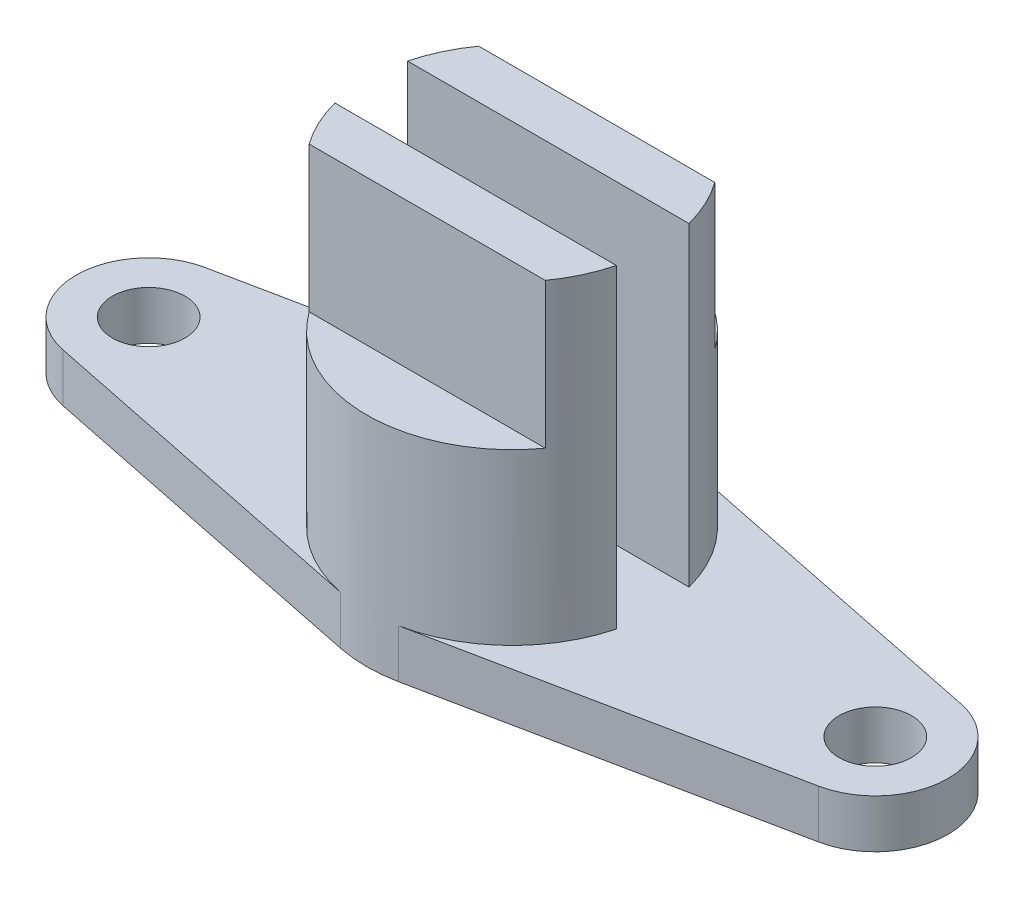
from build123d import *

# Parameters (mm, degrees)
SKETCH1_R               = 7.5
BOSS_EXTRUDE1_DEPTH     = 10
SKETCH2_R               = 30
BOSS_EXTRUDE2_DEPTH     = 65
CUT_EXTRUDE1_DEPTH      = 121.933866224
CUT_EXTRUDE1_DEPTH_BACK = 121.933866224
SKETCH3_W               = 15
SKETCH3_H               = 65
SKETCH5_W               = 12.5
SKETCH5_H               = 30
CUT_EXTRUDE2_DEPTH      = 121.933866224


with BuildPart() as part:
    # Sketch1 → Boss-Extrude1 (new body)
    with BuildSketch(Plane(origin=(0, 0, 0), x_dir=(1, 0, 0), z_dir=(0, 1, 0))):
        with BuildLine():
            Line((6, 29.393876913), (78, 14.696938457))
            ThreePointArc((78, 14.696938457), (90, 0), (78, -14.696938457))
            Line((78, -14.696938457), (6, -29.393876913))
            ThreePointArc((6, -29.393876913), (0, -30), (-6, -29.393876913))
            Line((-6, -29.393876913), (-78, -14.696938457))
            ThreePointArc((-78, -14.696938457), (-90, 0), (-78, 14.696938457))
            Line((-78, 14.696938457), (-6, 29.393876913))
            ThreePointArc((-6, 29.393876913), (0, 30), (6, 29.393876913))
        make_face()
        with Locations(Location((-75, 0, 0), (0, 0, 270))):
            Circle(SKETCH1_R, mode=Mode.SUBTRACT)
        with Locations(Location((75, 0, 0), (0, 0, 270))):
            Circle(SKETCH1_R, mode=Mode.SUBTRACT)
    extrude(amount=BOSS_EXTRUDE1_DEPTH)

    # Sketch2 → Boss-Extrude2 (add)
    with BuildSketch(Plane(origin=(0, 10, 0), x_dir=(1, 0, 0), z_dir=(0, 1, 0))):
        with Locations(Location((0, 0, 0), (0, 0, 78.463040967))):
            Circle(SKETCH2_R)
    extrude(amount=BOSS_EXTRUDE2_DEPTH)

    # Sketch3 → Cut-Extrude1 (cut, two sides: drawn at the far end of the back side and taken through both)
    with BuildSketch(Plane(origin=(0, 0, 0), x_dir=(0, 0, -1), z_dir=(1, 0, 0)).offset(-CUT_EXTRUDE1_DEPTH_BACK)):
        with Locations((0, 42.5)):
            Rectangle(SKETCH3_W, SKETCH3_H)
    extrude(amount=CUT_EXTRUDE1_DEPTH + CUT_EXTRUDE1_DEPTH_BACK, mode=Mode.SUBTRACT)

    # Sketch5 → Cut-Extrude2 (cut, symmetric)
    with BuildSketch(Plane(origin=(0, 0, 0), x_dir=(0, 0, -1), z_dir=(1, 0, 0))):
        with Locations((-23.75, 60)):
            Rectangle(SKETCH5_W, SKETCH5_H)
    cut_extrude2 = extrude(amount=CUT_EXTRUDE2_DEPTH, both=True, mode=Mode.SUBTRACT)

    # Mirror1: Cut-Extrude2 across plane
    add(cut_extrude2.mirror(Plane.XY), mode=Mode.SUBTRACT)


solid = part.part
